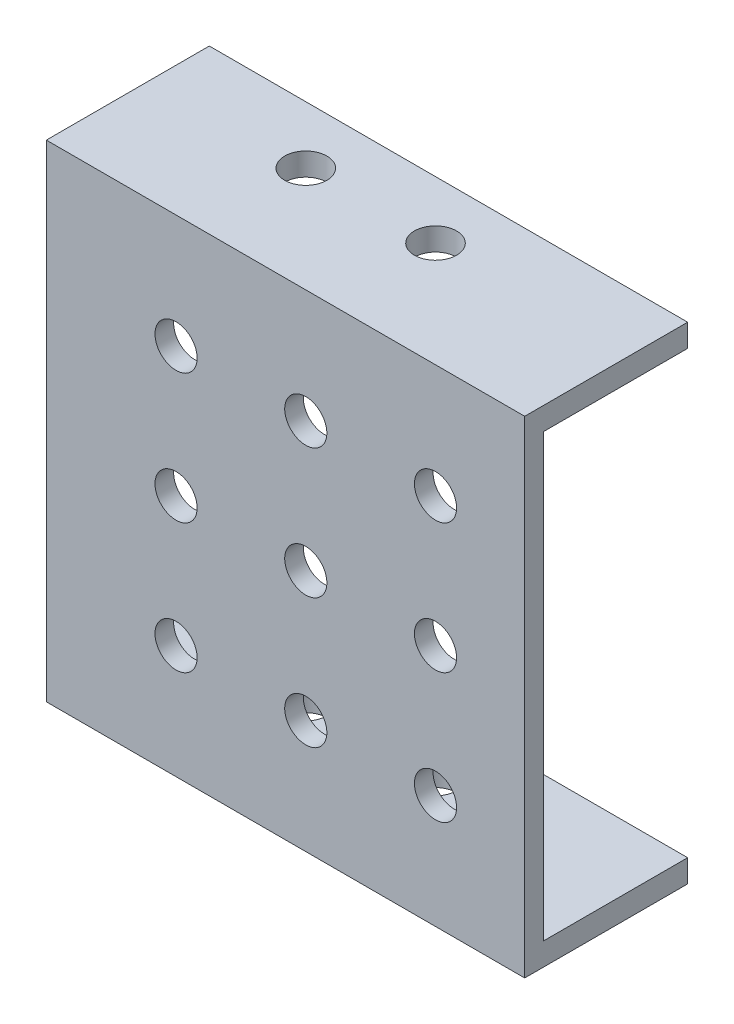
from build123d import *

# Parameters (mm, degrees)
SKETCH_1_W          = 295
SKETCH_1_H          = 300
SKETCH_1_R          = 13
EXTRUDE_466_DEPTH   = 11.5
SKETCH_2_W          = 295
SKETCH_2_H          = 14
EXTRUDE_1_DEPTH     = 89
SKETCH_3_R          = 13
CUT_EXTRUDE_1_DEPTH = 346.943998358


with BuildPart() as part:
    # 草图1 → Extrude 466 (new body)
    with BuildSketch(Plane.XY):
        with Locations((0, 150)):
            Rectangle(SKETCH_1_W, SKETCH_1_H)
        with Locations((92.5, 230)):
            Circle(SKETCH_1_R, mode=Mode.SUBTRACT)
        with Locations((92.5, 150)):
            Circle(SKETCH_1_R, mode=Mode.SUBTRACT)
        with Locations((92.5, 70)):
            Circle(SKETCH_1_R, mode=Mode.SUBTRACT)
        with Locations((12.5, 230)):
            Circle(SKETCH_1_R, mode=Mode.SUBTRACT)
        with Locations((-67.5, 230)):
            Circle(SKETCH_1_R, mode=Mode.SUBTRACT)
        with Locations((-67.5, 150)):
            Circle(SKETCH_1_R, mode=Mode.SUBTRACT)
        with Locations((-67.5, 70)):
            Circle(SKETCH_1_R, mode=Mode.SUBTRACT)
        with Locations((12.5, 70)):
            Circle(SKETCH_1_R, mode=Mode.SUBTRACT)
        with Locations((12.5, 150)):
            Circle(SKETCH_1_R, mode=Mode.SUBTRACT)
    extrude(amount=EXTRUDE_466_DEPTH)

    # 草图2 → 凸台-拉伸1 (add)
    with BuildSketch(Plane(origin=(0, 0, 0), x_dir=(-1, 0, 0), z_dir=(0, 0, -1))):
        with Locations((0, 293)):
            Rectangle(SKETCH_2_W, SKETCH_2_H)
        with Locations((0, 7)):
            Rectangle(SKETCH_2_W, SKETCH_2_H)
    extrude(amount=EXTRUDE_1_DEPTH)

    # 草图3 → 切除-拉伸1 (cut, through all)
    with BuildSketch(Plane(origin=(0, 300, 0), x_dir=(-1, 0, 0), z_dir=(0, 1, 0))):
        with Locations(Location((-27.5, -53.5, 0), (0, 0, 90))):
            Circle(SKETCH_3_R)
        with Locations(Location((52.5, -53.5, 0), (0, 0, 90))):
            Circle(SKETCH_3_R)
    extrude(amount=-CUT_EXTRUDE_1_DEPTH, mode=Mode.SUBTRACT)


solid = part.part
